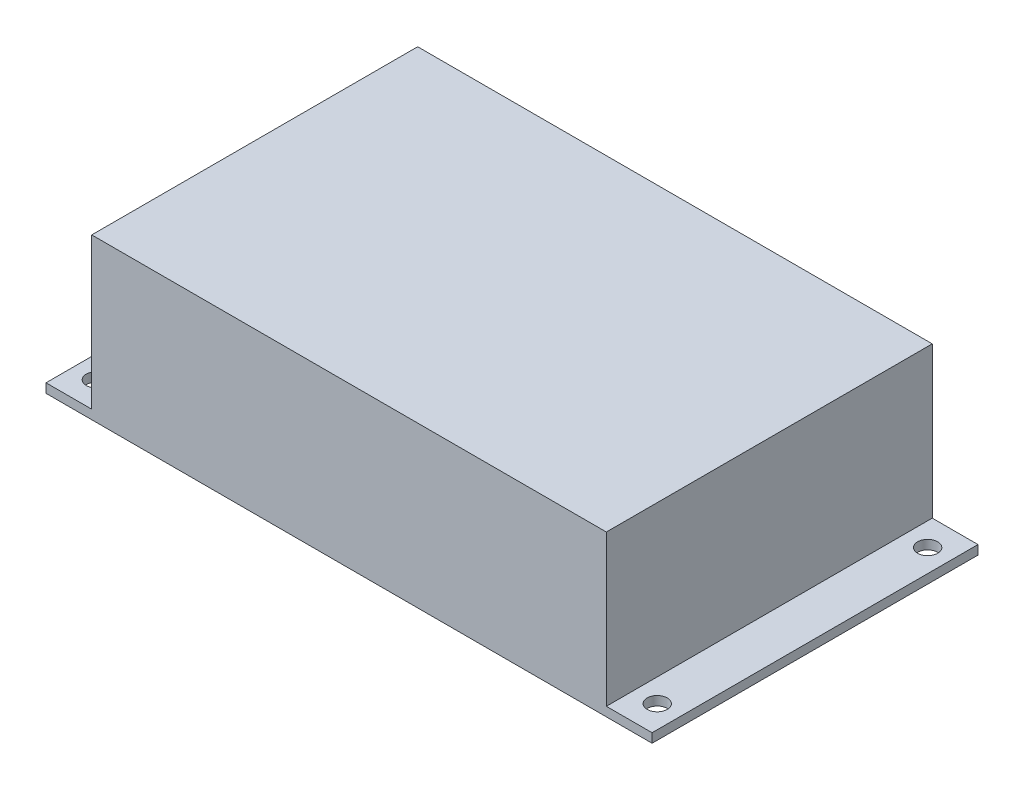
from build123d import *

# Parameters (mm, degrees)
SKETCH_1_W          = 106
SKETCH_1_H          = 57
EXTRUDE_1_DEPTH     = 1.6
SKETCH_2_R          = 1.75
CUT_EXTRUDE_1_DEPTH = 1.6
SKETCH_3_W          = 90
SKETCH_3_H          = 57
EXTRUDE_2_DEPTH     = 26.4


with BuildPart() as part:
    # 草图1 → 凸台-拉伸1 (new body)
    with BuildSketch(Plane(origin=(0, 0, 0), x_dir=(1, 0, 0), z_dir=(0, 1, 0))):
        Rectangle(SKETCH_1_W, SKETCH_1_H)
    extrude(amount=EXTRUDE_1_DEPTH)

    # 草图2 → 切除-拉伸1 (cut)
    with BuildSketch(Plane(origin=(0, 1.6, 0), x_dir=(1, 0, 0), z_dir=(0, 1, 0))):
        with Locations(Location((-49.05, 23.65, 0), (0, 0, 270))):
            Circle(SKETCH_2_R)
        with Locations(Location((-49.05, -23.65, 0), (0, 0, 90))):
            Circle(SKETCH_2_R)
        with Locations(Location((49.05, -23.65, 0), (0, 0, 270))):
            Circle(SKETCH_2_R)
        with Locations(Location((49.05, 23.65, 0), (0, 0, 90))):
            Circle(SKETCH_2_R)
    extrude(amount=-CUT_EXTRUDE_1_DEPTH, mode=Mode.SUBTRACT)

    # 草图3 → 凸台-拉伸2 (add)
    with BuildSketch(Plane(origin=(0, 1.6, 0), x_dir=(1, 0, 0), z_dir=(0, 1, 0))):
        Rectangle(SKETCH_3_W, SKETCH_3_H)
    extrude(amount=EXTRUDE_2_DEPTH)


solid = part.part
